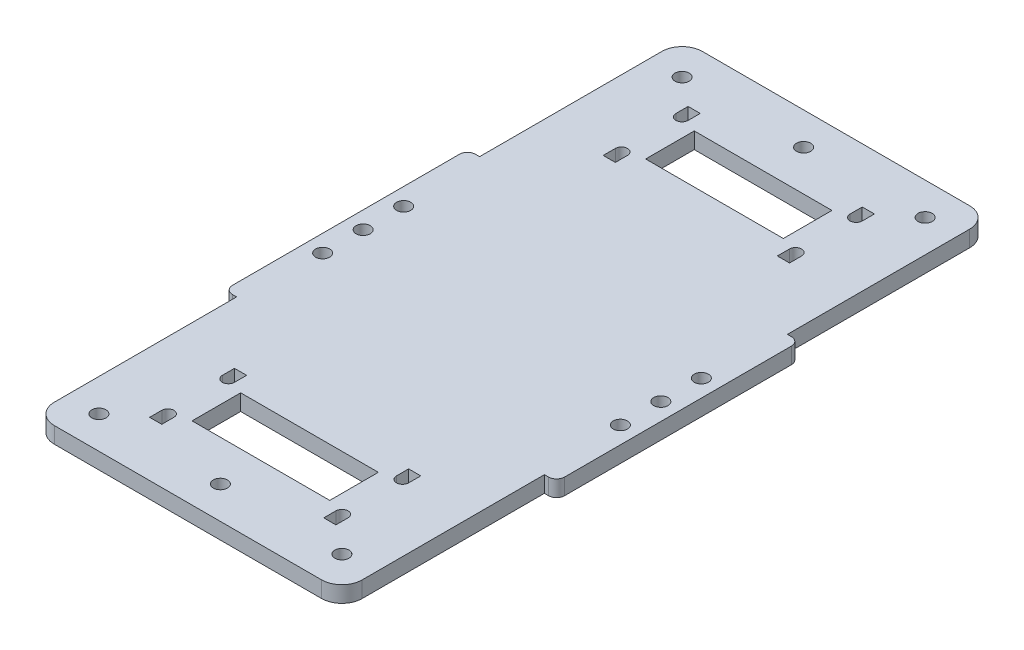
from build123d import *

# Parameters (mm, degrees)
SKETCH_1_W               = 82
SKETCH_1_H               = 100
EXTRUDE_1_DEPTH          = 4
SKETCH_2_W               = 82
SKETCH_2_H               = 4
EXTRUDE_2_DEPTH          = 60
CUT_EXTRUDE_1_DEPTH      = 118.460631703
CUT_EXTRUDE_1_DEPTH_BACK = 118.460631703
SKETCH_3_W               = 3
SKETCH_3_H               = 50
CUT_EXTRUDE_2_DEPTH      = 118.460631703
CUT_EXTRUDE_2_DEPTH_BACK = 118.460631703
SKETCH_5_R               = 1.75
CUT_EXTRUDE_3_DEPTH      = 118.460631703
CUT_EXTRUDE_3_DEPTH_BACK = 118.460631703
SKETCH_6_R               = 1.75
CUT_EXTRUDE_4_DEPTH      = 118.460631703
CUT_EXTRUDE_4_DEPTH_BACK = 118.460631703
SKETCH_7_W               = 34
SKETCH_7_H               = 12
FILLET_1_R               = 5
FILLET_2_R               = 2
CUT_EXTRUDE_5_DEPTH      = 118.460631703
CUT_EXTRUDE_5_DEPTH_BACK = 118.460631703
SKETCH_8_R               = 1.75
CUT_EXTRUDE_6_DEPTH      = 118.460631703
CUT_EXTRUDE_6_DEPTH_BACK = 118.460631703
CUT_EXTRUDE_7_DEPTH      = 118.460631703
CUT_EXTRUDE_7_DEPTH_BACK = 118.460631703
SKETCH_10_R              = 1.75


with BuildPart() as part:
    # 草图1 → 凸台-拉伸1 (new body)
    with BuildSketch(Plane(origin=(0, 0, 0), x_dir=(1, 0, 0), z_dir=(0, 1, 0))):
        Rectangle(SKETCH_1_W, SKETCH_1_H)
    extrude(amount=EXTRUDE_1_DEPTH)

    # 草图2 → 凸台-拉伸2 (add)
    with BuildSketch(Plane.XY.offset(50)):
        with Locations((0, 2)):
            Rectangle(SKETCH_2_W, SKETCH_2_H)
    extrude(amount=EXTRUDE_2_DEPTH)

    # 草图3 → 切除-拉伸1 (cut, two sides: drawn at the far end of the back side and taken through both)
    with BuildSketch(Plane(origin=(0, 4, 0), x_dir=(1, 0, 0), z_dir=(0, 1, 0)).offset(-CUT_EXTRUDE_1_DEPTH_BACK)):
        with Locations((-39.5, 25)):
            Rectangle(SKETCH_3_W, SKETCH_3_H)
        with Locations((39.5, 25)):
            Rectangle(SKETCH_3_W, SKETCH_3_H)
        with Locations((-39.5, -85)):
            Rectangle(SKETCH_3_W, SKETCH_3_H)
        with Locations((39.5, -85)):
            Rectangle(SKETCH_3_W, SKETCH_3_H)
    extrude(amount=CUT_EXTRUDE_1_DEPTH + CUT_EXTRUDE_1_DEPTH_BACK, mode=Mode.SUBTRACT)

    # 草图5 → 切除-拉伸2 (cut, two sides: drawn at the far end of the back side and taken through both)
    with BuildSketch(Plane(origin=(0, 4, 0), x_dir=(1, 0, 0), z_dir=(0, 1, 0)).offset(-CUT_EXTRUDE_2_DEPTH_BACK)):
        with Locations(Location((-30, 42, 0), (0, 0, 270))):
            Circle(SKETCH_5_R)
    extrude(amount=CUT_EXTRUDE_2_DEPTH + CUT_EXTRUDE_2_DEPTH_BACK, mode=Mode.SUBTRACT)

    # 草图6 → 切除-拉伸3 (cut, two sides: drawn at the far end of the back side and taken through both)
    with BuildSketch(Plane(origin=(0, 4, 0), x_dir=(1, 0, 0), z_dir=(0, 1, 0)).offset(-CUT_EXTRUDE_3_DEPTH_BACK)):
        with Locations(Location((30, 42, 0), (0, 0, 270))):
            Circle(SKETCH_6_R)
        with Locations(Location((-30, -102, 0), (0, 0, 270))):
            Circle(SKETCH_6_R)
        with Locations(Location((30, -102, 0), (0, 0, 270))):
            Circle(SKETCH_6_R)
    extrude(amount=CUT_EXTRUDE_3_DEPTH + CUT_EXTRUDE_3_DEPTH_BACK, mode=Mode.SUBTRACT)

    # 草图7 → 切除-拉伸4 (cut, two sides: drawn at the far end of the back side and taken through both)
    with BuildSketch(Plane(origin=(0, 4, 0), x_dir=(1, 0, 0), z_dir=(0, 1, 0)).offset(-CUT_EXTRUDE_4_DEPTH_BACK)):
        with Locations((0, -86)):
            Rectangle(SKETCH_7_W, SKETCH_7_H)
        with Locations((0, 26)):
            Rectangle(SKETCH_7_W, SKETCH_7_H)
    extrude(amount=CUT_EXTRUDE_4_DEPTH + CUT_EXTRUDE_4_DEPTH_BACK, mode=Mode.SUBTRACT)

    # 圆角1
    fillet_1_edges = [part.edges().sort_by_distance(p)[0] for p in [
        (38, 2, -50),
        (-38, 2, 110),
        (38, 2, 110),
        (-38, 2, -50),
    ]]
    fillet(fillet_1_edges, radius=FILLET_1_R)

    # 圆角2
    fillet_2_edges = [part.edges().sort_by_distance(p)[0] for p in [
        (41, 2, 0),
        (-41, 2, 60),
        (41, 2, 60),
        (-41, 2, 0),
    ]]
    fillet(fillet_2_edges, radius=FILLET_2_R)

    # 草图8 → 切除-拉伸5 (cut, two sides: drawn at the far end of the back side and taken through both)
    with BuildSketch(Plane(origin=(0, 4, 0), x_dir=(1, 0, 0), z_dir=(0, 1, 0)).offset(-CUT_EXTRUDE_5_DEPTH_BACK)):
        with Locations(Location((0, 42, 0), (0, 0, 270))):
            Circle(SKETCH_8_R)
        with Locations(Location((0, -102, 0), (0, 0, 270))):
            Circle(SKETCH_8_R)
    extrude(amount=CUT_EXTRUDE_5_DEPTH + CUT_EXTRUDE_5_DEPTH_BACK, mode=Mode.SUBTRACT)

    # 草图9 → 切除-拉伸6 (cut, two sides: drawn at the far end of the back side and taken through both)
    with BuildSketch(Plane(origin=(0, 4, 0), x_dir=(1, 0, 0), z_dir=(0, 1, 0)).offset(-CUT_EXTRUDE_6_DEPTH_BACK)):
        with BuildLine():
            Line((20, 33.477548097), (20, 36.477548097))
            Line((20, 36.477548097), (23, 36.477548097))
            Line((23, 36.477548097), (23, 33.477548097))
            ThreePointArc((23, 33.477548097), (21.5, 31.977548097), (20, 33.477548097))
        make_face()
        with BuildLine():
            Line((-23, 36.477548097), (-23, 33.477548097))
            ThreePointArc((-23, 33.477548097), (-21.5, 31.977548097), (-20, 33.477548097))
            Line((-20, 33.477548097), (-20, 36.477548097))
            Line((-20, 36.477548097), (-23, 36.477548097))
        make_face()
        with BuildLine():
            Line((-20, -93.477548097), (-20, -96.477548097))
            Line((-20, -96.477548097), (-23, -96.477548097))
            Line((-23, -96.477548097), (-23, -93.477548097))
            ThreePointArc((-23, -93.477548097), (-21.5, -91.977548097), (-20, -93.477548097))
        make_face()
        with BuildLine():
            Line((23, -96.477548097), (23, -93.477548097))
            ThreePointArc((23, -93.477548097), (21.5, -91.977548097), (20, -93.477548097))
            Line((20, -93.477548097), (20, -96.477548097))
            Line((20, -96.477548097), (23, -96.477548097))
        make_face()
        with BuildLine():
            Line((-20, 18.517447437), (-20, 15.517447437))
            Line((-20, 15.517447437), (-23, 15.517447437))
            Line((-23, 15.517447437), (-23, 18.517447437))
            ThreePointArc((-23, 18.517447437), (-21.5, 20.017447437), (-20, 18.517447437))
        make_face()
        with BuildLine():
            Line((23, 15.517447437), (23, 18.517447437))
            ThreePointArc((23, 18.517447437), (21.5, 20.017447437), (20, 18.517447437))
            Line((20, 18.517447437), (20, 15.517447437))
            Line((20, 15.517447437), (23, 15.517447437))
        make_face()
        with BuildLine():
            Line((20, -78.522451903), (20, -75.522451903))
            Line((20, -75.522451903), (23, -75.522451903))
            Line((23, -75.522451903), (23, -78.522451903))
            ThreePointArc((23, -78.522451903), (21.5, -80.022451903), (20, -78.522451903))
        make_face()
        with BuildLine():
            Line((-23, -75.522451903), (-23, -78.522451903))
            ThreePointArc((-23, -78.522451903), (-21.5, -80.022451903), (-20, -78.522451903))
            Line((-20, -78.522451903), (-20, -75.522451903))
            Line((-20, -75.522451903), (-23, -75.522451903))
        make_face()
    extrude(amount=CUT_EXTRUDE_6_DEPTH + CUT_EXTRUDE_6_DEPTH_BACK, mode=Mode.SUBTRACT)

    # 草图10 → 切除-拉伸7 (cut, two sides: drawn at the far end of the back side and taken through both)
    with BuildSketch(Plane(origin=(0, 4, 0), x_dir=(1, 0, 0), z_dir=(0, 1, 0)).offset(-CUT_EXTRUDE_7_DEPTH_BACK)):
        with Locations(Location((-36.75, -30, 0), (0, 0, 270))):
            Circle(SKETCH_10_R)
        with Locations(Location((36.75, -30, 0), (0, 0, 270))):
            Circle(SKETCH_10_R)
        with Locations(Location((-36.75, -20, 0), (0, 0, 270))):
            Circle(SKETCH_10_R)
        with Locations(Location((36.75, -20, 0), (0, 0, 270))):
            Circle(SKETCH_10_R)
        with Locations(Location((-36.75, -40, 0), (0, 0, 270))):
            Circle(SKETCH_10_R)
        with Locations(Location((36.75, -40, 0), (0, 0, 270))):
            Circle(SKETCH_10_R)
    extrude(amount=CUT_EXTRUDE_7_DEPTH + CUT_EXTRUDE_7_DEPTH_BACK, mode=Mode.SUBTRACT)


solid = part.part
